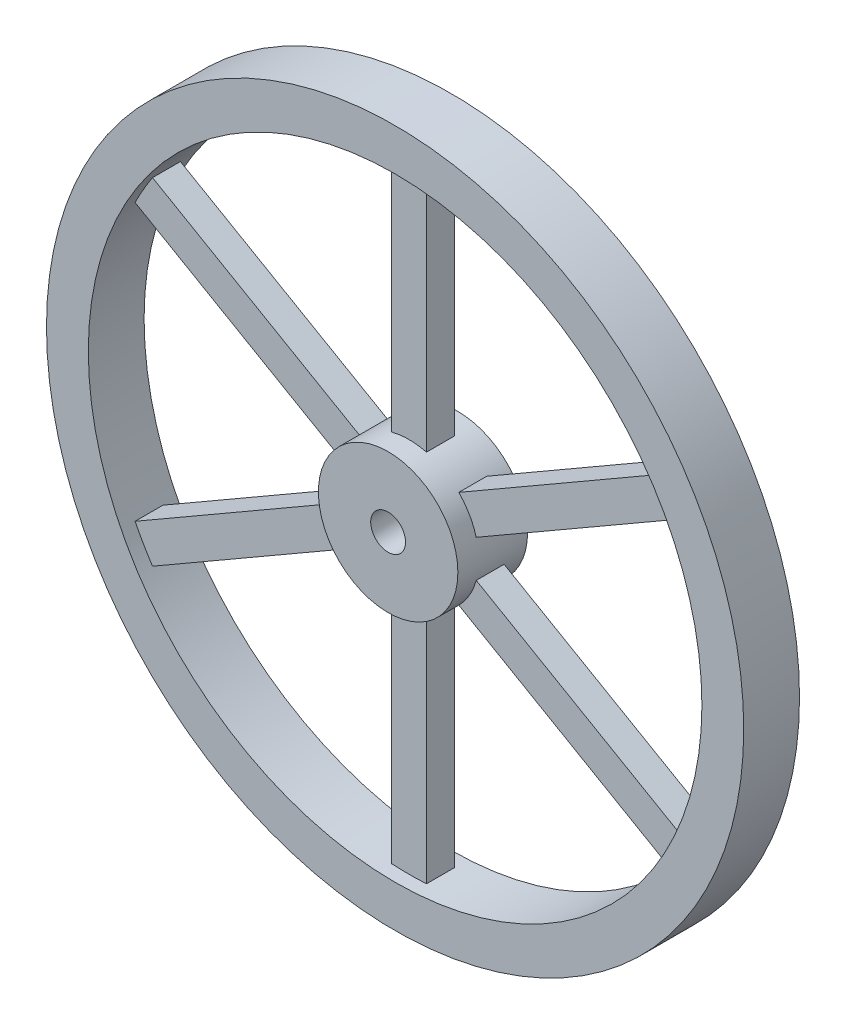
from build123d import *

# Parameters (mm, degrees)
SKETCH1_R           = 50
SKETCH1_R_2         = 44
BOSS_EXTRUDE1_DEPTH = 4
SKETCH2_R           = 10
BOSS_EXTRUDE2_DEPTH = 5
SKETCH3_W           = 5
SKETCH3_H           = 36
BOSS_EXTRUDE3_DEPTH = 2
SKETCH4_R           = 2.5
CUT_EXTRUDE1_DEPTH  = 6
CIRPATTERN1_COUNT   = 6


with BuildPart() as part:
    # Sketch1 → Boss-Extrude1 (new, symmetric)
    with BuildSketch(Plane.XY):
        Circle(SKETCH1_R)
        Circle(SKETCH1_R_2, mode=Mode.SUBTRACT)
    extrude(amount=BOSS_EXTRUDE1_DEPTH, both=True)



with BuildPart() as body_2:
    # Sketch2 → Boss-Extrude2 (new, symmetric)
    with BuildSketch(Plane.XY):
        Circle(SKETCH2_R)
    extrude(amount=BOSS_EXTRUDE2_DEPTH, both=True)


with BuildPart() as part_1:
    add(part.part)

    add(body_2.part)  # Boss-Extrude3 merges body 2
    # Sketch3 → Boss-Extrude3 (add, symmetric)
    with BuildSketch(Plane.XY):
        with Locations((0, 27)):
            Rectangle(SKETCH3_W, SKETCH3_H)
    boss_extrude3 = extrude(amount=BOSS_EXTRUDE3_DEPTH, both=True)

    # Sketch4 → Cut-Extrude1 (cut, symmetric)
    with BuildSketch(Plane.XY):
        Circle(SKETCH4_R)
    extrude(amount=CUT_EXTRUDE1_DEPTH, both=True, mode=Mode.SUBTRACT)

    # CirPattern1: Boss-Extrude3 ×6 about axis
    cirpattern1_axis = Axis((0, 0, 0), (0, 0, 1))
    for i in range(1, CIRPATTERN1_COUNT):
        add(boss_extrude3.rotate(cirpattern1_axis, i * 360 / CIRPATTERN1_COUNT))


solid = part_1.part
